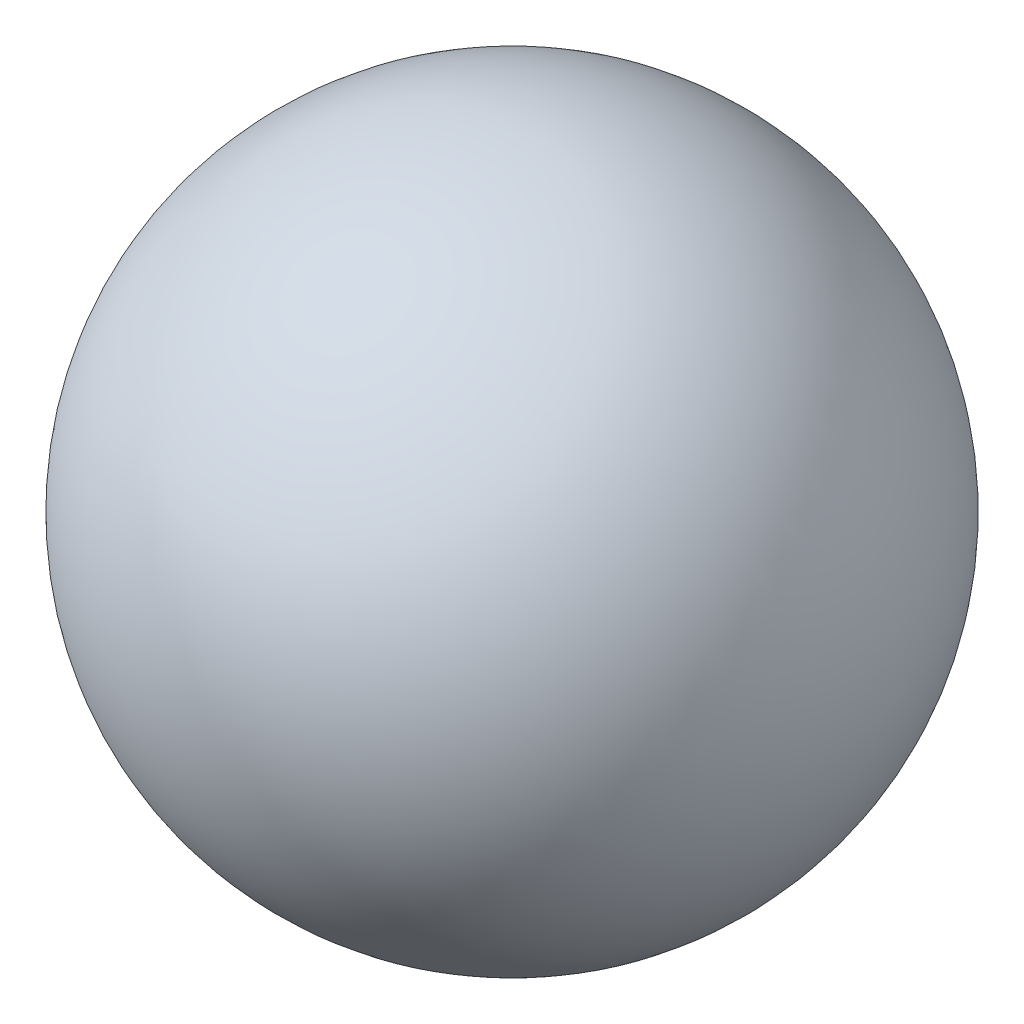
from build123d import *


with BuildPart() as part:
    # Sketch1 → Revolve1 (revolve)
    with BuildSketch(Plane.XY):
        with BuildLine():
            Line((121.253630278, 134.718709267), (121.253630278, 94.472459526))
            ThreePointArc((121.253630278, 94.472459526), (141.376755149, 114.595584397), (121.253630278, 134.718709267))
        make_face()
    revolve(axis=Axis((121.253630278, 134.718709267, 0), (0, -1, 0)))


with BuildPart() as part_1:
    # Body-Move/Copy1: moved
    add(part.part.moved(Location((0, 0, 22.544939106))))


solid = part_1.part
